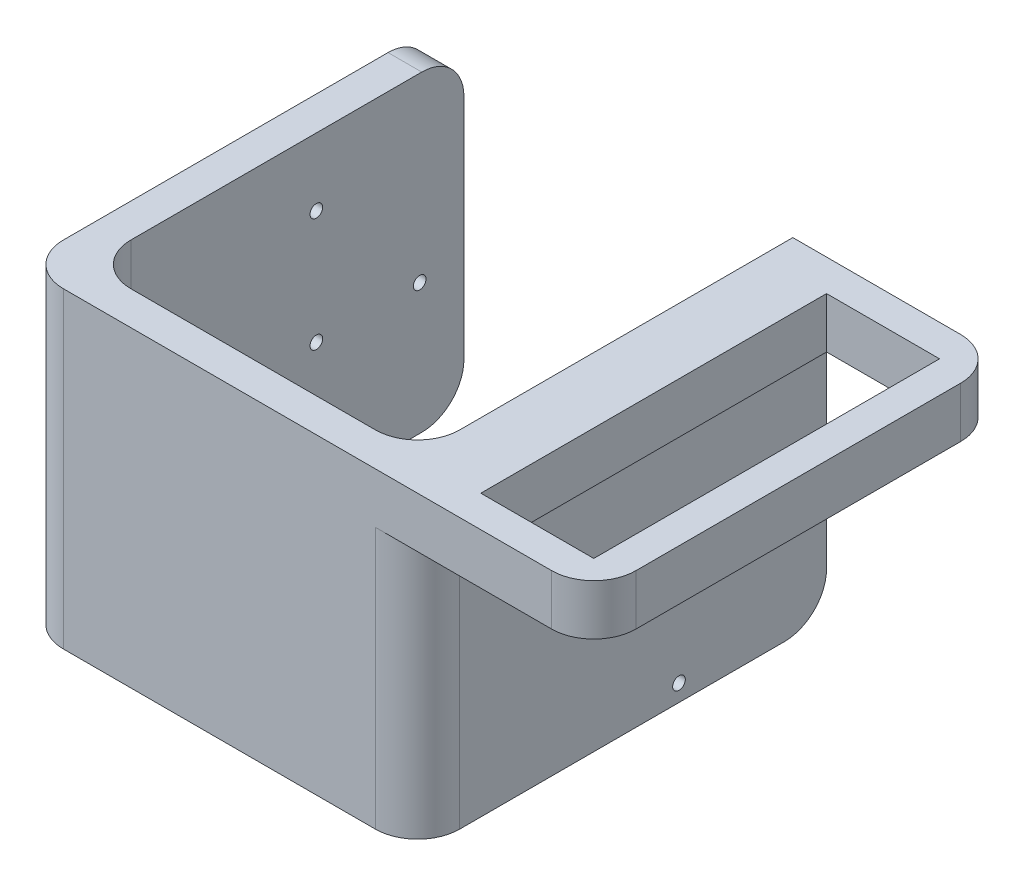
from build123d import *

# Parameters (mm, degrees)
SKETCH1_W           = 94
SKETCH1_H           = 74
BOSS_EXTRUDE1_DEPTH = 8
SKETCH3_W           = 8
SKETCH3_H           = 74
BOSS_EXTRUDE2_DEPTH = 89
SKETCH4_W           = 8
SKETCH4_H           = 74
BOSS_EXTRUDE3_DEPTH = 89
SKETCH7_W           = 97
SKETCH7_H           = 12
BOSS_EXTRUDE6_DEPTH = 41.8
SKETCH13_W          = 26.8
SKETCH13_H          = 82
CUT_EXTRUDE3_DEPTH  = 15
SKETCH19_R          = 1.5
CUT_EXTRUDE4_DEPTH  = 100
FILLET1_R           = 10
FILLET2_R           = 10
FILLET3_R           = 10
FILLET4_R           = 10
FILLET5_R           = 10
FILLET6_R           = 10
FILLET7_R           = 10
FILLET8_R           = 10


with BuildPart() as part:
    # Sketch1 → Boss-Extrude1 (new body)
    with BuildSketch(Plane.XY):
        Rectangle(SKETCH1_W, SKETCH1_H)
    extrude(amount=BOSS_EXTRUDE1_DEPTH)

    # Sketch3 → Boss-Extrude2 (add)
    with BuildSketch(Plane(origin=(0, 0, 0), x_dir=(-1, 0, 0), z_dir=(0, 0, -1))):
        with Locations((43, 0)):
            Rectangle(SKETCH3_W, SKETCH3_H)
    extrude(amount=BOSS_EXTRUDE2_DEPTH)

    # Sketch4 → Boss-Extrude3 (add)
    with BuildSketch(Plane(origin=(0, 0, 0), x_dir=(-1, 0, 0), z_dir=(0, 0, -1))):
        with Locations((-43, 0)):
            Rectangle(SKETCH4_W, SKETCH4_H)
    extrude(amount=BOSS_EXTRUDE3_DEPTH)

    # Sketch7 → Boss-Extrude6 (add)
    with BuildSketch(Plane(origin=(47, 0, 0), x_dir=(0, 0, -1), z_dir=(1, 0, 0))):
        with Locations((40.5, 31)):
            Rectangle(SKETCH7_W, SKETCH7_H)
    extrude(amount=BOSS_EXTRUDE6_DEPTH)

    # Sketch13 → Cut-Extrude3 (cut)
    with BuildSketch(Plane.XZ.offset(-25)):
        with Locations((67.9, -40.5)):
            Rectangle(SKETCH13_W, SKETCH13_H)
    extrude(amount=-CUT_EXTRUDE3_DEPTH, mode=Mode.SUBTRACT)

    # Sketch19 → Cut-Extrude4 (cut)
    with BuildSketch(Plane(origin=(47, 0, 0), x_dir=(0, 0, -1), z_dir=(1, 0, 0))):
        with Locations(Location((54, 21, 0), (0, 0, 90))):
            Circle(SKETCH19_R)
        with Locations(Location((29.5, -6, 0), (0, 0, 90))):
            Circle(SKETCH19_R)
        with Locations(Location((78.5, -6, 0), (0, 0, 90))):
            Circle(SKETCH19_R)
        with Locations(Location((54, -33, 0), (0, 0, 90))):
            Circle(SKETCH19_R)
        with Locations(Location((54, -6, 0), (0, 0, 90))):
            Circle(SKETCH19_R)
    extrude(amount=-CUT_EXTRUDE4_DEPTH, mode=Mode.SUBTRACT)

    # Fillet1
    fillet1_edges = [part.edges().sort_by_distance(p)[0] for p in [
        (-43, 37, -89),
        (47, -6, 8),
    ]]
    fillet(fillet1_edges, radius=FILLET1_R)

    # Fillet2
    fillet2_edges = [part.edges().sort_by_distance(p)[0] for p in [
        (-43, -37, -89),
    ]]
    fillet(fillet2_edges, radius=FILLET2_R)

    # Fillet3
    fillet3_edges = [part.edges().sort_by_distance(p)[0] for p in [
        (43, -37, -89),
    ]]
    fillet(fillet3_edges, radius=FILLET3_R)

    # Fillet4
    fillet4_edges = [part.edges().sort_by_distance(p)[0] for p in [
        (-47, 0, 8),
    ]]
    fillet(fillet4_edges, radius=FILLET4_R)

    # Fillet5
    fillet5_edges = [part.edges().sort_by_distance(p)[0] for p in [
        (88.8, 31, 8),
    ]]
    fillet(fillet5_edges, radius=FILLET5_R)

    # Fillet6
    fillet6_edges = [part.edges().sort_by_distance(p)[0] for p in [
        (88.8, 31, -89),
    ]]
    fillet(fillet6_edges, radius=FILLET6_R)

    # Fillet7
    fillet7_edges = [part.edges().sort_by_distance(p)[0] for p in [
        (-39, 0, 0),
    ]]
    fillet(fillet7_edges, radius=FILLET7_R)

    # Fillet8
    fillet8_edges = [part.edges().sort_by_distance(p)[0] for p in [
        (39, 0, 0),
    ]]
    fillet(fillet8_edges, radius=FILLET8_R)


solid = part.part
